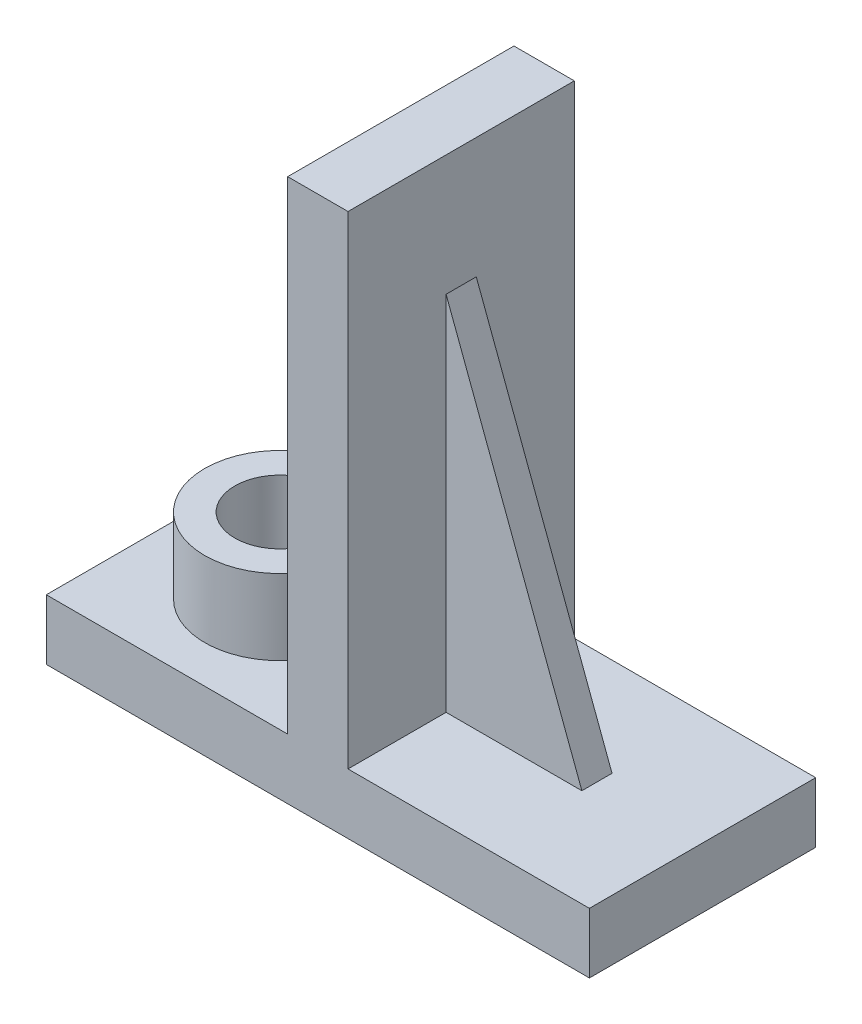
from build123d import *
from build123d.topology import SkipClean

# Parameters (mm, degrees)
BOSS_EXTRUDE1_DEPTH = 15
BOSS_EXTRUDE2_DEPTH = 2
SKETCH3_R           = 10
SKETCH3_R_2         = 6
BOSS_EXTRUDE3_DEPTH = 10
SKETCH4_R           = 6
CUT_EXTRUDE1_DEPTH  = 10


with BuildPart() as part:
    # Sketch1 → Boss-Extrude1 (new, symmetric)
    with BuildSketch(Plane.XY):
        Polygon((36, 0), (-36, 0), (-36, 8), (-4, 8), (-4, 72), (4, 72), (4, 8), (36, 8), align=None)
    extrude(amount=BOSS_EXTRUDE1_DEPTH, both=True)

    # Sketch2 → Boss-Extrude2 (add, symmetric)
    with BuildSketch(Plane.XY):
        Polygon((4, 8), (4, 56), (22, 8), align=None)
    extrude(amount=BOSS_EXTRUDE2_DEPTH, both=True)

    # Sketch3 → Boss-Extrude3 (add)
    with BuildSketch(Plane(origin=(0, 8, 0), x_dir=(1, 0, 0), z_dir=(0, 1, 0))):
        with Locations(Location((-20, 0, 0), (0, 0, 90))):
            Circle(SKETCH3_R)
        with Locations(Location((-20, 0, 0), (0, 0, 270))):
            Circle(SKETCH3_R_2, mode=Mode.SUBTRACT)
    extrude(amount=BOSS_EXTRUDE3_DEPTH)

    # Sketch4 → Cut-Extrude1 (cut)
    with SkipClean():  # the faces are left unmerged after this step: merging them gives an invalid solid
        with BuildSketch(Plane.XZ):
            with Locations(Location((-20, 0, 0), (0, 0, 270))):
                Circle(SKETCH4_R)
        extrude(amount=-CUT_EXTRUDE1_DEPTH, mode=Mode.SUBTRACT)


solid = part.part
